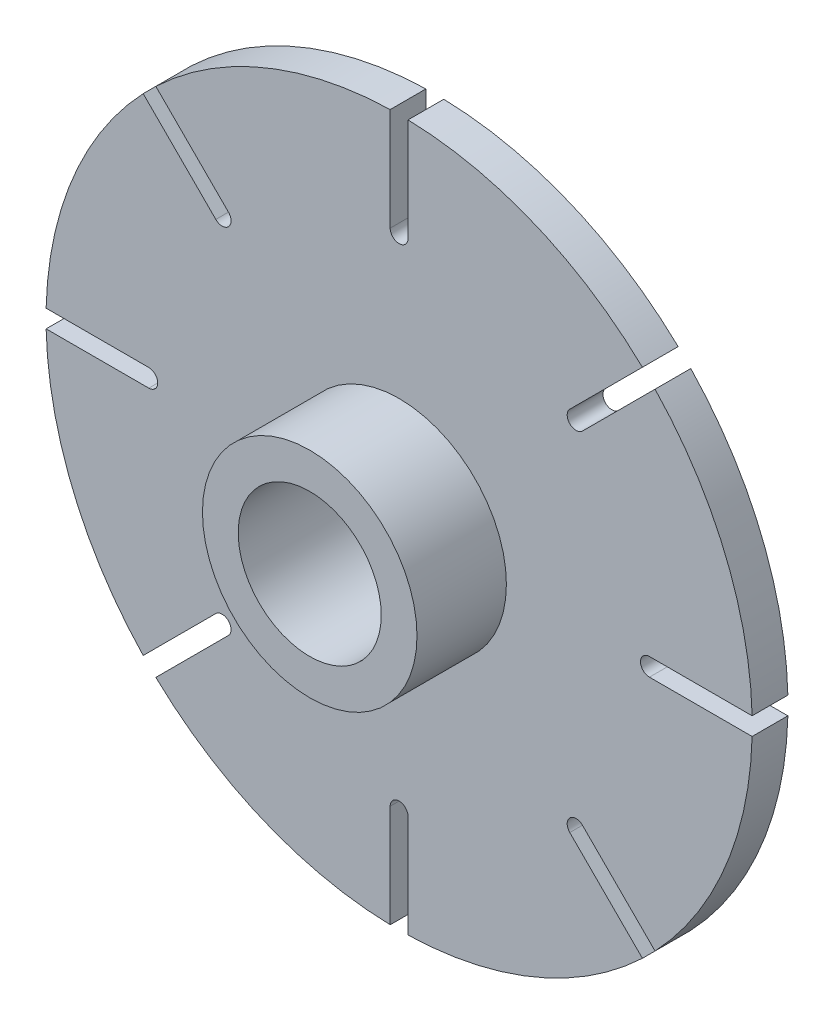
from build123d import *

# Parameters (mm, degrees)
SKETCH1_R           = 6
SKETCH1_R_2         = 4
BOSS_EXTRUDE1_DEPTH = 7
SKETCH2_R           = 6
BOSS_EXTRUDE2_DEPTH = 2


with BuildPart() as part:
    # Sketch1 → Boss-Extrude1 (new body)
    with BuildSketch(Plane.XY):
        Circle(SKETCH1_R)
        Circle(SKETCH1_R_2, mode=Mode.SUBTRACT)
    extrude(amount=BOSS_EXTRUDE1_DEPTH)

    # Sketch2 → Boss-Extrude2 (add)
    with BuildSketch(Plane(origin=(0, 0, 0), x_dir=(-1, 0, 0), z_dir=(0, 0, -1))):
        with BuildLine():
            ThreePointArc((0.5, 14), (0, 13.5), (-0.5, 14))
            Line((-0.5, 14), (-0.5, 19.743669872))
            ThreePointArc((-0.5, 19.743669872), (-7.557997789, 18.246620767), (-13.607329461, 14.314436242))
            Line((-13.607329461, 14.314436242), (-9.545941546, 10.253048327))
            ThreePointArc((-9.545941546, 10.253048327), (-9.43755517, 10.090836653), (-9.399494937, 9.899494937))
            ThreePointArc((-9.399494937, 9.899494937), (-9.70815322, 9.43755517), (-10.253048327, 9.545941546))
            Line((-10.253048327, 9.545941546), (-14.314436242, 13.607329461))
            ThreePointArc((-14.314436242, 13.607329461), (-18.246620767, 7.557997789), (-19.743669872, 0.5))
            Line((-19.743669872, 0.5), (-14, 0.5))
            ThreePointArc((-14, 0.5), (-13.646446609, 0.353553391), (-13.5, 0))
            ThreePointArc((-13.5, 0), (-13.646446609, -0.353553391), (-14, -0.5))
            Line((-14, -0.5), (-19.743669872, -0.5))
            ThreePointArc((-19.743669872, -0.5), (-18.246620767, -7.557997789), (-14.314436242, -13.607329461))
            Line((-14.314436242, -13.607329461), (-10.253048327, -9.545941546))
            ThreePointArc((-10.253048327, -9.545941546), (-9.70815322, -9.43755517), (-9.399494937, -9.899494937))
            ThreePointArc((-9.399494937, -9.899494937), (-9.43755517, -10.090836653), (-9.545941546, -10.253048327))
            Line((-9.545941546, -10.253048327), (-13.607329461, -14.314436242))
            ThreePointArc((-13.607329461, -14.314436242), (-7.557997789, -18.246620767), (-0.5, -19.743669872))
            Line((-0.5, -19.743669872), (-0.5, -14))
            ThreePointArc((-0.5, -14), (0, -13.5), (0.5, -14))
            Line((0.5, -14), (0.5, -19.743669872))
            ThreePointArc((0.5, -19.743669872), (7.557997789, -18.246620767), (13.607329461, -14.314436242))
            Line((13.607329461, -14.314436242), (9.545941546, -10.253048327))
            ThreePointArc((9.545941546, -10.253048327), (9.545941546, -9.545941546), (10.253048327, -9.545941546))
            Line((10.253048327, -9.545941546), (14.314436242, -13.607329461))
            ThreePointArc((14.314436242, -13.607329461), (18.246620767, -7.557997789), (19.743669872, -0.5))
            Line((19.743669872, -0.5), (14, -0.5))
            ThreePointArc((14, -0.5), (13.5, 0), (14, 0.5))
            Line((14, 0.5), (19.743669872, 0.5))
            ThreePointArc((19.743669872, 0.5), (18.246620767, 7.557997789), (14.314436242, 13.607329461))
            Line((14.314436242, 13.607329461), (10.253048327, 9.545941546))
            ThreePointArc((10.253048327, 9.545941546), (9.545941546, 9.545941546), (9.545941546, 10.253048327))
            Line((9.545941546, 10.253048327), (13.607329461, 14.314436242))
            ThreePointArc((13.607329461, 14.314436242), (7.557997789, 18.246620767), (0.5, 19.743669872))
            Line((0.5, 19.743669872), (0.5, 14))
        make_face()
        Circle(SKETCH2_R, mode=Mode.SUBTRACT)
    extrude(amount=-BOSS_EXTRUDE2_DEPTH)


solid = part.part
